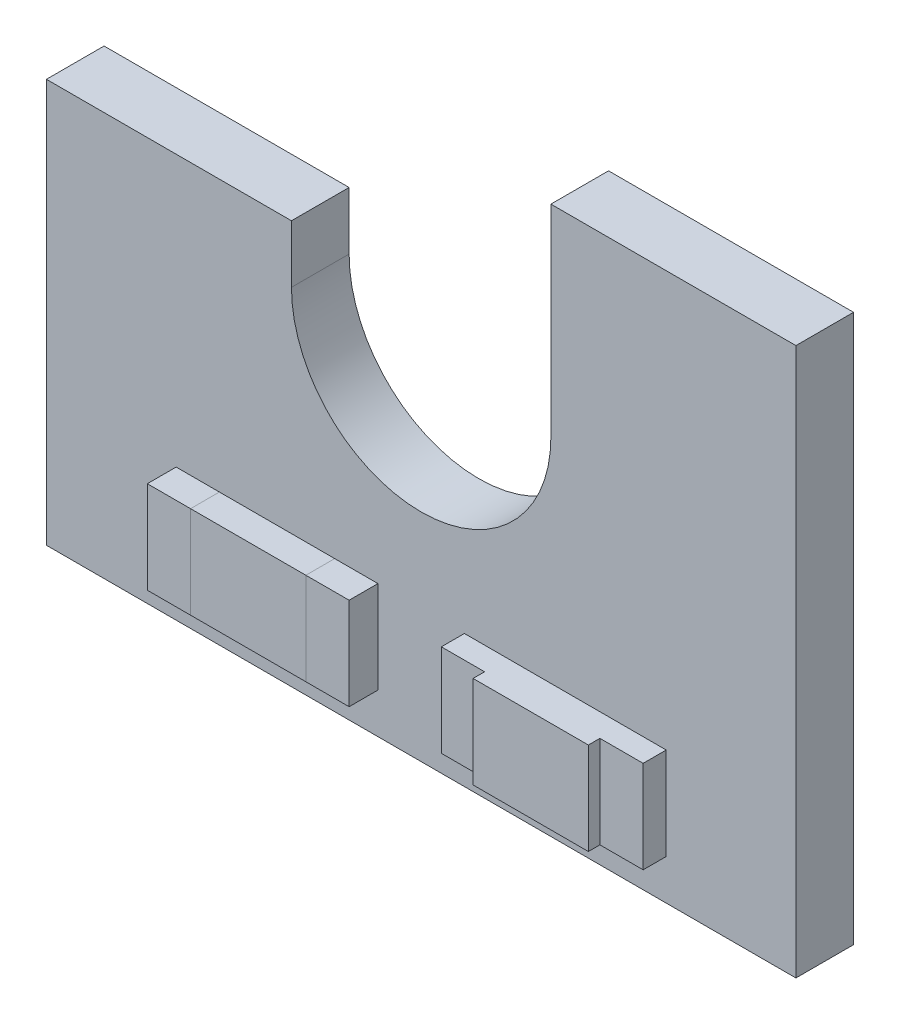
from build123d import *

# Parameters (mm, degrees)
BASES_W                           = 13
BASES_H                           = 9.5
BASE_DEPTH                        = 1
FASTENER_ACCESS_DEPTH             = 9.11249037
SMDCAPACITORBODYS_W               = 2
SMDCAPACITORBODYS_H               = 1.6
SMD_CAPACITOR_BODY_DEPTH          = 0.5
SMDCAPACITORSOLDERBODY1S_W        = 1.6
SMDCAPACITORSOLDERBODY1S_H        = 0.5
SMD_CAPACITOR_SOLDER_BODY_1_DEPTH = 0.75
SMDCAPACITORSOLDERBODY2S_W        = 1.6
SMDCAPACITORSOLDERBODY2S_H        = 0.5
SMD_CAPACITOR_SOLDER_BODY_2_DEPTH = 0.75
LEDS_W                            = 3.5
LEDS_H                            = 1.6
LED_DEPTH                         = 0.4
LEDTS_W                           = 2
LEDTS_H                           = 1.6
LED_TOP_DEPTH                     = 0.2
SKETCH1_W                         = 4.25
SKETCH1_H                         = 2.5
PCB_LEFT_CUT_DEPTH                = 9.11249037


with BuildPart() as part:
    # BaseS → BASE (new body)
    with BuildSketch(Plane.XY):
        Rectangle(BASES_W, BASES_H)
    extrude(amount=-BASE_DEPTH)

    # FastenerAccessS → FASTENER ACCESS (cut, through all)
    with BuildSketch(Plane.XY):
        with BuildLine():
            Line((-2.25, 4.75), (2.25, 4.75))
            Line((2.25, 4.75), (2.25, 1.25))
            ThreePointArc((2.25, 1.25), (0, -1), (-2.25, 1.25))
            Line((-2.25, 1.25), (-2.25, 4.75))
        make_face()
    extrude(amount=-FASTENER_ACCESS_DEPTH, mode=Mode.SUBTRACT)

    # Sketch1 → PCB Left Cut (cut, through all)
    with BuildSketch(Plane.XY):
        with Locations((-4.375, 3.5)):
            Rectangle(SKETCH1_W, SKETCH1_H)
    extrude(amount=-PCB_LEFT_CUT_DEPTH, mode=Mode.SUBTRACT)


with BuildPart() as body_2:
    # SMDCapacitorBodyS → SMD CAPACITOR BODY (new body)
    with BuildSketch(Plane.XY):
        with Locations((-2.5, -3.25)):
            Rectangle(SMDCAPACITORBODYS_W, SMDCAPACITORBODYS_H)
    extrude(amount=SMD_CAPACITOR_BODY_DEPTH)


with BuildPart() as body_3:
    # SMDCapacitorSolderBody1S → SMD CAPACITOR SOLDER BODY 1 (new body)
    with BuildSketch(Plane(origin=(-3.5, -0.45, 0), x_dir=(0, 1, 0), z_dir=(1, 0, 0))):
        with Locations((-2.8, 0.25)):
            Rectangle(SMDCAPACITORSOLDERBODY1S_W, SMDCAPACITORSOLDERBODY1S_H)
    extrude(amount=-SMD_CAPACITOR_SOLDER_BODY_1_DEPTH)


with BuildPart() as body_4:
    # SMDCapacitorSolderBody2S → SMD CAPACITOR SOLDER BODY 2 (new body)
    with BuildSketch(Plane(origin=(-1.5, -1.05, 0), x_dir=(0, 1, 0), z_dir=(-1, 0, 0))):
        with Locations((-2.2, -0.25)):
            Rectangle(SMDCAPACITORSOLDERBODY2S_W, SMDCAPACITORSOLDERBODY2S_H)
    extrude(amount=-SMD_CAPACITOR_SOLDER_BODY_2_DEPTH)


with BuildPart() as body_5:
    # LEDS → LED (new body)
    with BuildSketch(Plane.XY):
        with Locations((2.5, -3.25)):
            Rectangle(LEDS_W, LEDS_H)
    extrude(amount=LED_DEPTH)

    # LEDTS → LED TOP (add)
    with BuildSketch(Plane.XY.offset(0.4)):
        with Locations((2.5, -3.25)):
            Rectangle(LEDTS_W, LEDTS_H)
    extrude(amount=LED_TOP_DEPTH)


solid = Compound([part.part, body_2.part, body_3.part, body_4.part, body_5.part])
